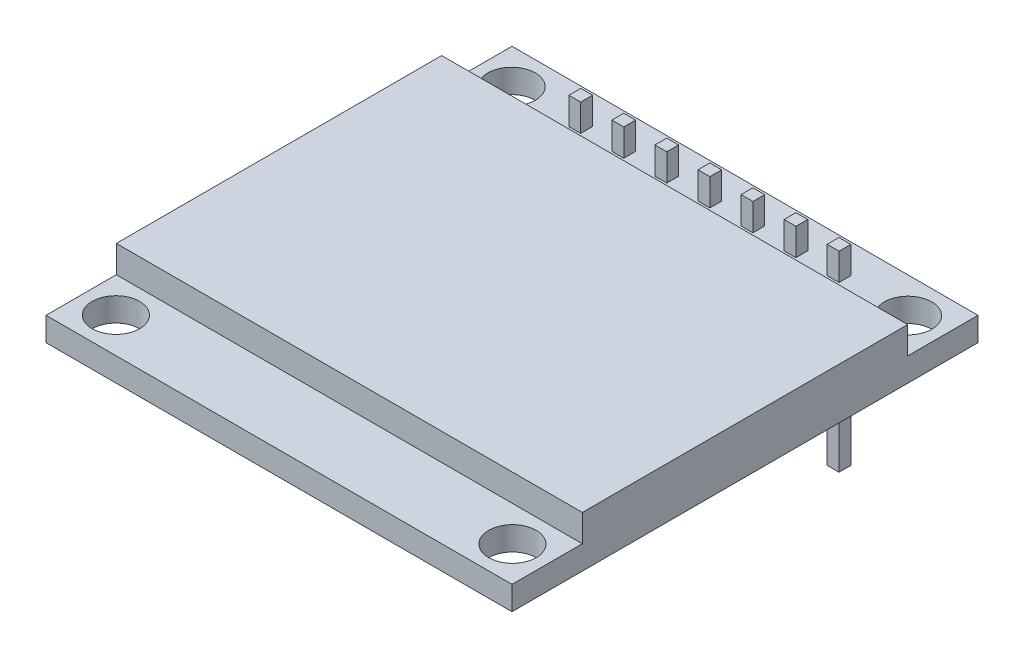
from build123d import *

# Parameters (mm, degrees)
SKETCH_1_W      = 27.5
SKETCH_1_H      = 27.5
SKETCH_1_R      = 1.4
EXTRUDE_1_DEPTH = 1.4
SKETCH_1_3_W    = 27.5
SKETCH_1_3_H    = 19.2
EXTRUDE_2_DEPTH = 3
SKETCH_1_4_W    = 2.54
SKETCH_1_4_H    = 2.54
EXTRUDE_3_DEPTH = 2.54
EXTRUDE_START   = 3
SKETCH_1_5_W    = 0.7
SKETCH_1_5_H    = 0.7
EXTRUDE_4_DEPTH = 11.3


with BuildPart() as part:
    # 草图1 → 凸台-拉伸1 (new body)
    with BuildSketch(Plane(origin=(0, 0, 0), x_dir=(1, 0, 0), z_dir=(0, 1, 0))):
        with Locations((13.75, -13.75)):
            Rectangle(SKETCH_1_W, SKETCH_1_H)
        with Locations(Location((2.05, -2.075, 0), (0, 0, 270))):
            Circle(SKETCH_1_R, mode=Mode.SUBTRACT)
        with Locations(Location((25.45, -2.075, 0), (0, 0, 270))):
            Circle(SKETCH_1_R, mode=Mode.SUBTRACT)
        with Locations(Location((2.05, -25.425, 0), (0, 0, 270))):
            Circle(SKETCH_1_R, mode=Mode.SUBTRACT)
        with Locations(Location((25.45, -25.425, 0), (0, 0, 270))):
            Circle(SKETCH_1_R, mode=Mode.SUBTRACT)
    extrude(amount=EXTRUDE_1_DEPTH)

    # 草图1<3> → 凸台-拉伸2 (add)
    with BuildSketch(Plane(origin=(0, 0, 0), x_dir=(1, 0, 0), z_dir=(0, 1, 0))):
        with Locations((13.75, -13.75)):
            Rectangle(SKETCH_1_3_W, SKETCH_1_3_H)
    extrude(amount=EXTRUDE_2_DEPTH)

    # 草图1<4> → 凸台-拉伸3 (add)
    with BuildSketch(Plane(origin=(0, 0, 0), x_dir=(1, 0, 0), z_dir=(0, 1, 0))):
        with Locations((6.13, -2.075)):
            Rectangle(SKETCH_1_4_W, SKETCH_1_4_H)
        with Locations((8.67, -2.075)):
            Rectangle(SKETCH_1_4_W, SKETCH_1_4_H)
        with Locations((11.21, -2.075)):
            Rectangle(SKETCH_1_4_W, SKETCH_1_4_H)
        with Locations((13.75, -2.075)):
            Rectangle(SKETCH_1_4_W, SKETCH_1_4_H)
        with Locations((16.29, -2.075)):
            Rectangle(SKETCH_1_4_W, SKETCH_1_4_H)
        with Locations((18.83, -2.075)):
            Rectangle(SKETCH_1_4_W, SKETCH_1_4_H)
        with Locations((21.37, -2.075)):
            Rectangle(SKETCH_1_4_W, SKETCH_1_4_H)
    extrude(amount=-EXTRUDE_3_DEPTH)

    # 草图1<5> → 凸台-拉伸4 (add)
    with BuildSketch(Plane(origin=(0, 0, 0), x_dir=(1, 0, 0), z_dir=(0, 1, 0)).offset(EXTRUDE_START)):
        with Locations((6.13, -2.075)):
            Rectangle(SKETCH_1_5_W, SKETCH_1_5_H)
        with Locations((8.67, -2.075)):
            Rectangle(SKETCH_1_5_W, SKETCH_1_5_H)
        with Locations((11.21, -2.075)):
            Rectangle(SKETCH_1_5_W, SKETCH_1_5_H)
        with Locations((13.75, -2.075)):
            Rectangle(SKETCH_1_5_W, SKETCH_1_5_H)
        with Locations((16.29, -2.075)):
            Rectangle(SKETCH_1_5_W, SKETCH_1_5_H)
        with Locations((18.83, -2.075)):
            Rectangle(SKETCH_1_5_W, SKETCH_1_5_H)
        with Locations((21.37, -2.075)):
            Rectangle(SKETCH_1_5_W, SKETCH_1_5_H)
    extrude(amount=-EXTRUDE_4_DEPTH)


solid = part.part
